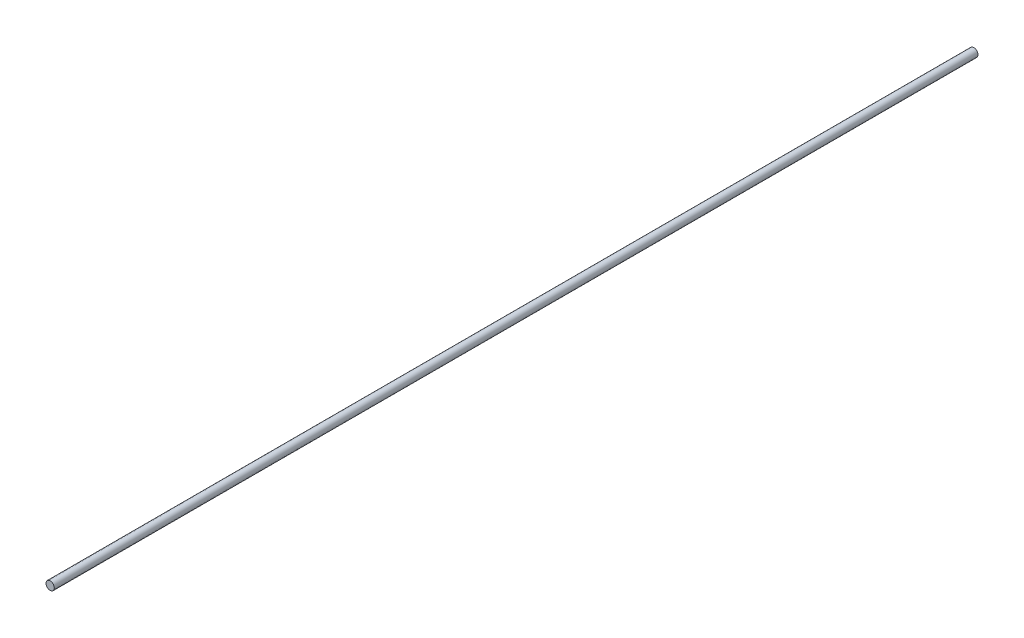
from build123d import *

# Parameters (mm, degrees)
ESQUISSE1_R        = 0.9
BOSS_EXTRU_1_DEPTH = 200


with BuildPart() as part:
    # Esquisse1 → Boss.-Extru.1 (new body)
    with BuildSketch(Plane.XY):
        Circle(ESQUISSE1_R)
    extrude(amount=BOSS_EXTRU_1_DEPTH)


solid = part.part
